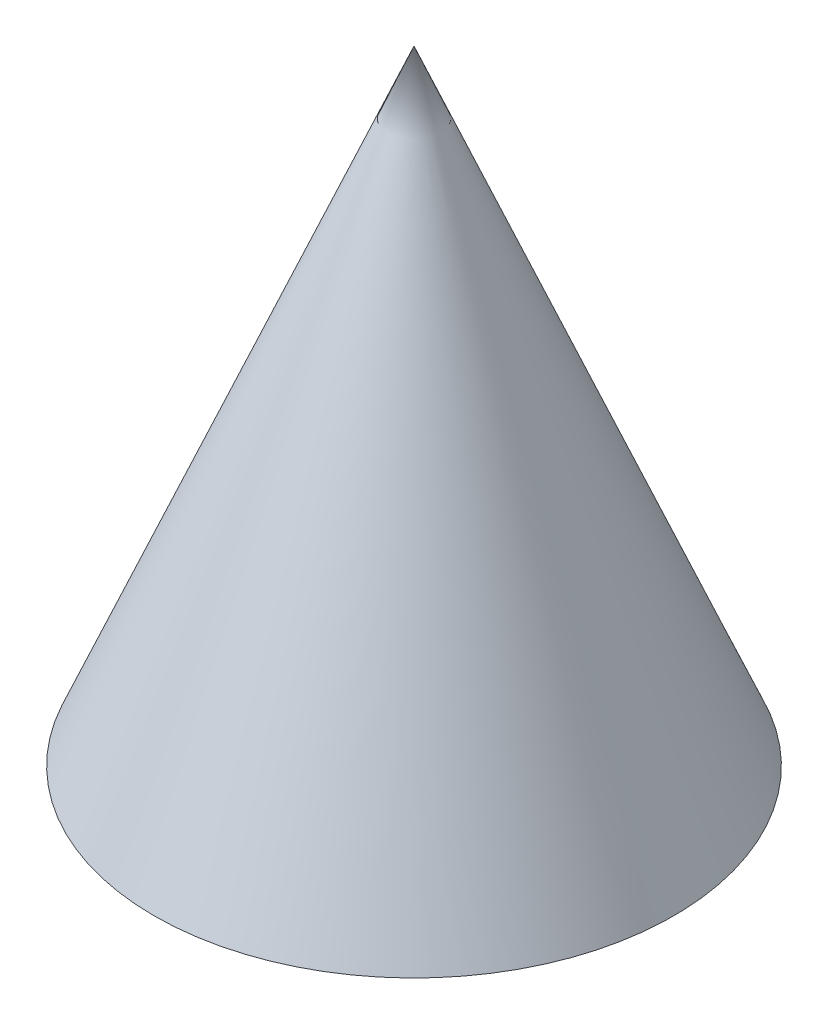
from build123d import *

# Parameters (mm, degrees)
CROQUIS_AGUJEROS_MONTAJE_R = 4
AGUJERO_INSERTO_M6_DEPTH   = 14


with BuildPart() as part:
    # Croquis_perfil → Cono_D100x120 (revolve)
    with BuildSketch(Plane.XY, mode=Mode.PRIVATE) as cono_d100x120_sk:
        Polygon((0, 0), (50, 0), (0, 120), align=None)
    revolve(cono_d100x120_sk.sketch.rotate(Axis((0, 0, 0), (0, 1, 0)), 90), axis=Axis((0, 0, 0), (0, 1, 0)))

    # Croquis_agujeros_montaje → Agujero_inserto_M6 (cut)
    with BuildSketch(Plane(origin=(0, 0, 0), x_dir=(1, 0, 0), z_dir=(0, 1, 0))):
        with Locations(Location((0, 0, 0), (0, 0, 270))):
            Circle(CROQUIS_AGUJEROS_MONTAJE_R)
    extrude(amount=AGUJERO_INSERTO_M6_DEPTH, mode=Mode.SUBTRACT)


solid = part.part
